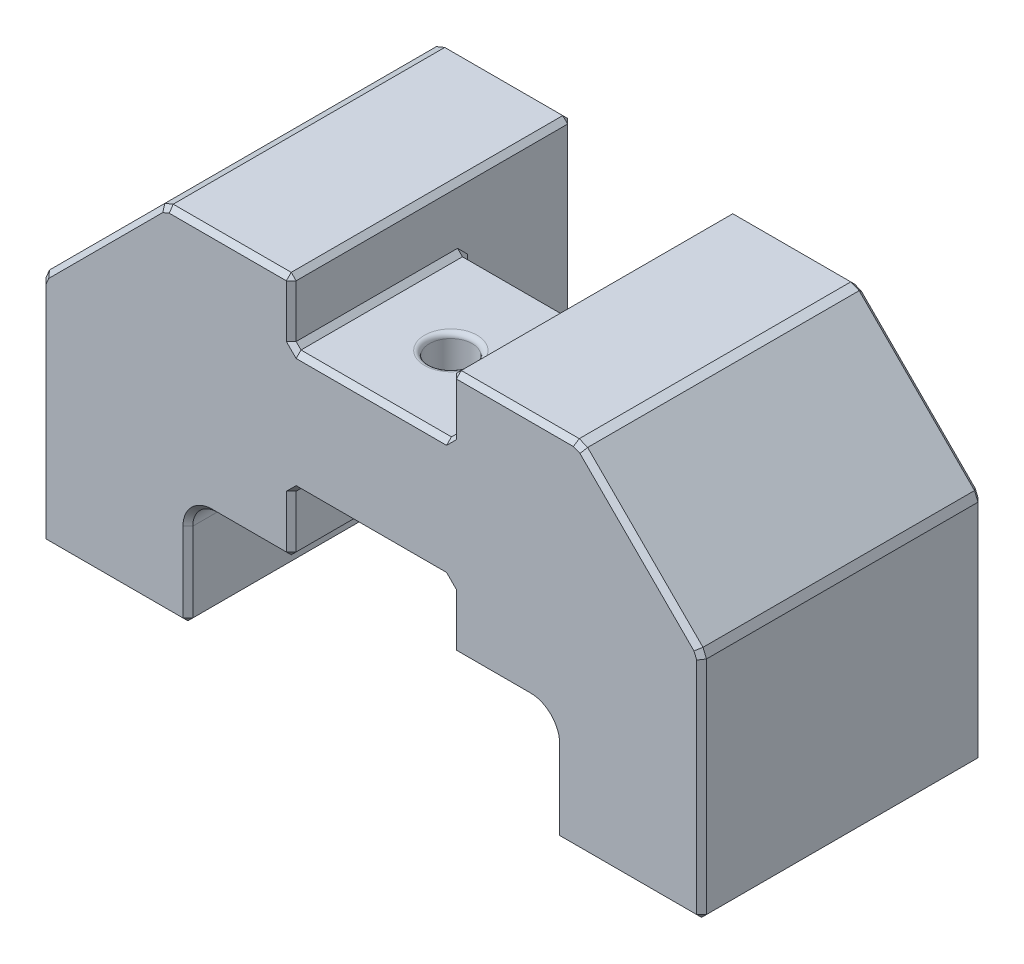
from build123d import *

# Parameters (mm, degrees)
BOSS_EXTRUDE1_DEPTH = 23
SKETCH1_4_W         = 13.1
SKETCH1_4_H         = 9.8
CUT_EXTRUDE1_DEPTH  = 9
CHAMFER4_SIZE       = 10
CHAMFER6_SIZE       = 0.4
CUT_EXTRUDE5_DEPTH  = 43.713463919
FILLET1_R           = 0.4
CHAMFER7_SIZE       = 0.4


with BuildPart() as part:
    # Sketch1 → Boss-Extrude1 (new body)
    with BuildSketch(Plane.XY):
        with BuildLine():
            Line((-27, 6.1), (-15, 6.1))
            Line((-15, 6.1), (-15, 13))
            ThreePointArc((-15, 13), (-14.414213562, 14.414213562), (-13, 15))
            Line((-13, 15), (-6.55, 15))
            Line((-6.55, 15), (-6.55, 20.1))
            Line((-6.55, 20.1), (6.55, 20.1))
            Line((6.55, 20.1), (6.55, 15))
            Line((6.55, 15), (13, 15))
            ThreePointArc((13, 15), (14.414213562, 14.414213562), (15, 13))
            Line((15, 13), (15, 6.1))
            Line((15, 6.1), (27, 6.1))
            Line((27, 6.1), (27, 35))
            Line((27, 35), (6.55, 35))
            Line((6.55, 35), (6.55, 29.9))
            Line((6.55, 29.9), (-6.55, 29.9))
            Line((-6.55, 29.9), (-6.55, 35))
            Line((-6.55, 35), (-27, 35))
            Line((-27, 35), (-27, 6.1))
        make_face()
    extrude(amount=BOSS_EXTRUDE1_DEPTH)

    # Sketch1<4> → Cut-Extrude1 (cut)
    with BuildSketch(Plane.XY):
        with Locations((0, 25)):
            Rectangle(SKETCH1_4_W, SKETCH1_4_H)
    extrude(amount=CUT_EXTRUDE1_DEPTH, mode=Mode.SUBTRACT)

    # Chamfer4
    chamfer4_edges = [part.edges().sort_by_distance(p)[0] for p in [
        (-27, 35, 11.5),
        (27, 35, 11.5),
    ]]
    chamfer(chamfer4_edges, length=CHAMFER4_SIZE)

    # Chamfer6
    chamfer6_edges = [part.edges().sort_by_distance(p)[0] for p in [
        (17, 35, 11.5),
        (27, 25, 11.5),
        (-27, 25, 11.5),
        (-17, 35, 11.5),
    ]]
    chamfer(chamfer6_edges, length=CHAMFER6_SIZE)

    # Sketch6 → Cut-Extrude5 (cut, through all)
    with BuildSketch(Plane(origin=(0, 29.9, 0), x_dir=(1, 0, 0), z_dir=(0, 1, 0))):
        with BuildLine():
            ThreePointArc((1.75, -16.5), (1.237436867, -15.262563133), (0, -14.75))
            Line((0, -14.75), (0, -18.25))
            ThreePointArc((0, -18.25), (1.237436867, -17.737436867), (1.75, -16.5))
        make_face()
        with BuildLine():
            Line((0, -18.25), (0, -14.75))
            ThreePointArc((0, -14.75), (-1.75, -16.5), (0, -18.25))
        make_face()
    extrude(amount=-CUT_EXTRUDE5_DEPTH, mode=Mode.SUBTRACT)

    # Fillet1
    fillet1_edges = [part.edges().sort_by_distance(p)[0] for p in [
        (0, 29.9, 14.75),
    ]]
    fillet(fillet1_edges, radius=FILLET1_R)

    # Chamfer7
    chamfer7_edges = [part.edges().sort_by_distance(p)[0] for p in [
        (15, 9.55, 23),
        (16.941421356, 34.858578644, 0),
        (21, 6.1, 23),
        (27, 15.35, 23),
        (9.775, 15, 0),
        (6.55, 25, 0),
        (-6.55, 25, 0),
        (-9.775, 15, 0),
        (-14.414213562, 14.414213562, 0),
        (-15, 9.55, 0),
        (-21, 6.1, 0),
        (-11.575, 35, 0),
        (27, 15.35, 0),
        (21, 6.1, 0),
        (15, 9.55, 0),
        (14.414213562, 14.414213562, 0),
        (6.55, 32.45, 23),
        (6.55, 15, 11.5),
        (6.55, 20.1, 16),
        (-6.55, 20.1, 16),
        (-6.55, 15, 11.5),
        (-15, 6.1, 11.5),
        (-27, 6.1, 11.5),
        (-6.55, 35, 11.5),
        (-6.55, 29.9, 16),
        (6.55, 29.9, 16),
        (6.55, 35, 11.5),
        (27, 6.1, 11.5),
        (15, 6.1, 11.5),
        (0, 29.9, 23),
        (-6.55, 32.45, 23),
        (-11.575, 35, 23),
        (14.414213562, 14.414213562, 23),
        (-21, 6.1, 23),
        (0, 29.9, 9),
        (6.55, 25, 9),
        (-6.55, 25, 9),
        (0, 20.1, 9),
        (-15, 9.55, 23),
        (-14.414213562, 14.414213562, 23),
        (-9.775, 15, 23),
        (-6.55, 17.55, 23),
        (0, 20.1, 23),
        (-27, 15.35, 23),
        (-27, 15.35, 0),
        (6.55, 17.55, 23),
        (-22, 30, 0),
        (-16.941421356, 34.858578644, 0),
        (-26.858578644, 24.941421356, 0),
        (-22, 30, 23),
        (22, 30, 23),
        (9.775, 15, 23),
        (11.575, 35, 23),
        (26.858578644, 24.941421356, 23),
        (16.941421356, 34.858578644, 23),
        (-16.941421356, 34.858578644, 23),
        (-26.858578644, 24.941421356, 23),
        (11.575, 35, 0),
        (22, 30, 0),
        (26.858578644, 24.941421356, 0),
    ]]
    chamfer(chamfer7_edges, length=CHAMFER7_SIZE)


solid = part.part
